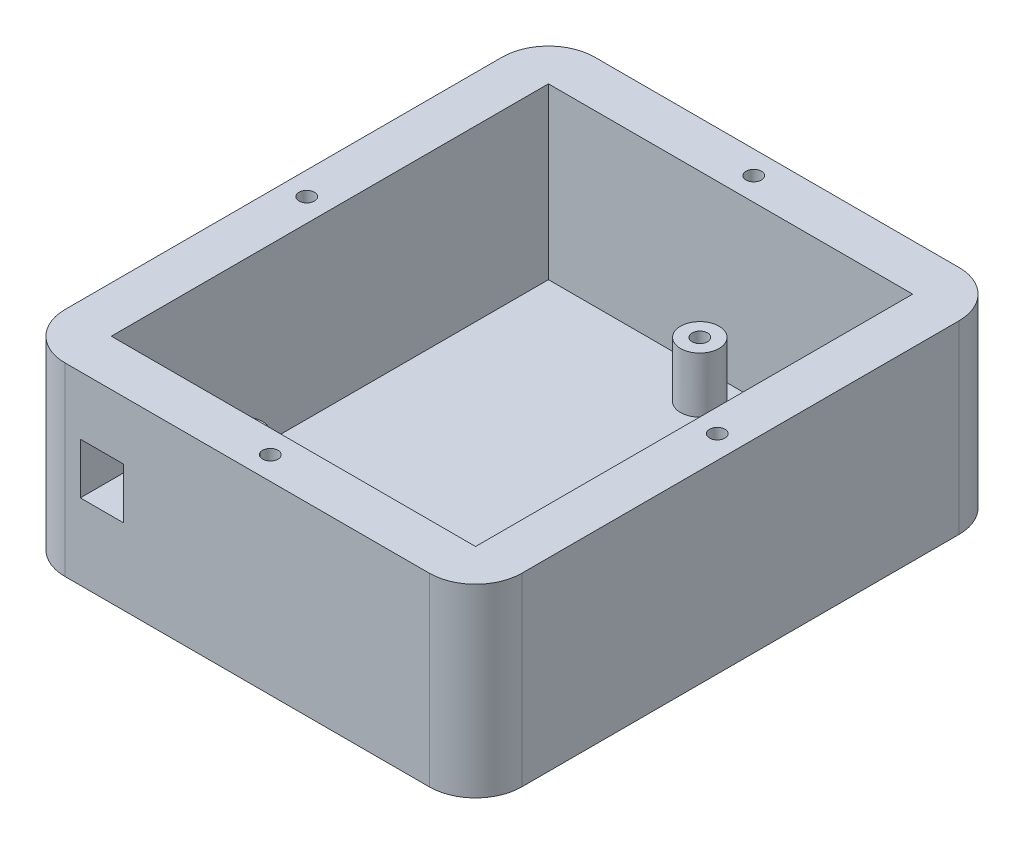
from build123d import *

# Parameters (mm, degrees)
BOSS_EXTRUDE1_DEPTH = 38.1
SKETCH2_W           = 75.000000114
SKETCH2_H           = 90.000000086
CUT_EXTRUDE1_DEPTH  = 34.925
SKETCH3_R           = 3.96875
SKETCH3_R_2         = 1.5875
BOSS_EXTRUDE2_DEPTH = 11.43
BOSS_EXTRUDE3_DEPTH = 38.1
SKETCH5_R           = 1.5875
CUT_EXTRUDE2_DEPTH  = 12.7
SKETCH9_W           = 8.89
SKETCH9_H           = 10.4775
CUT_EXTRUDE3_DEPTH  = 9.525


with BuildPart() as part:
    # Sketch1 → Boss-Extrude1 (new body)
    with BuildSketch(Plane(origin=(0, 0, 0), x_dir=(1, 0, 0), z_dir=(0, 1, 0))):
        with BuildLine():
            Line((3.175, 0), (78.175000114, 0))
            ThreePointArc((78.175000114, 0), (80.420064144, 0.92993597), (81.350000114, 3.175))
            Line((81.350000114, 3.175), (81.350000114, 93.175000086))
            ThreePointArc((81.350000114, 93.175000086), (80.420064144, 95.420064116), (78.175000114, 96.350000086))
            Line((78.175000114, 96.350000086), (3.175, 96.350000086))
            ThreePointArc((3.175, 96.350000086), (0.92993597, 95.420064116), (0, 93.175000086))
            Line((0, 93.175000086), (0, 3.175))
            ThreePointArc((0, 3.175), (0.92993597, 0.92993597), (3.175, 0))
        make_face()
    extrude(amount=BOSS_EXTRUDE1_DEPTH)

    # Sketch2 → Cut-Extrude1 (cut)
    with BuildSketch(Plane(origin=(0, 38.1, 0), x_dir=(1, 0, 0), z_dir=(0, 1, 0))):
        with Locations((40.675000057, 48.175000043)):
            Rectangle(SKETCH2_W, SKETCH2_H)
    extrude(amount=-CUT_EXTRUDE1_DEPTH, mode=Mode.SUBTRACT)

    # Sketch3 → Boss-Extrude2 (add)
    # profile 1 of 2: a face of its own
    with BuildSketch(Plane(origin=(0, 3.175, 0), x_dir=(1, 0, 0), z_dir=(0, 1, 0))):
        with Locations(Location((40.465000057, 87.050000043, 0), (0, 0, 90))):
            Circle(SKETCH3_R)
        with Locations(Location((40.465000057, 87.050000043, 0), (0, 0, 270))):
            Circle(SKETCH3_R_2, mode=Mode.SUBTRACT)
    # profile 2 of 2: a face of its own
    with BuildSketch(Plane(origin=(0, 3.175, 0), x_dir=(1, 0, 0), z_dir=(0, 1, 0))):
        with Locations(Location((10.465000057, 23.050000043, 0), (0, 0, 90))):
            Circle(SKETCH3_R)
        with Locations(Location((10.465000057, 23.050000043, 0), (0, 0, 270))):
            Circle(SKETCH3_R_2, mode=Mode.SUBTRACT)
    extrude(amount=BOSS_EXTRUDE2_DEPTH)

    # Sketch4 → Boss-Extrude3 (add)
    with BuildSketch(Plane.XZ):
        with BuildLine():
            Line((-6.35, -3.175), (-6.35, -93.175000086))
            ThreePointArc((-6.35, -93.175000086), (-3.560192091, -99.910192177), (3.175, -102.700000086))
            Line((3.175, -102.700000086), (78.175000114, -102.700000086))
            ThreePointArc((78.175000114, -102.700000086), (84.910192205, -99.910192177), (87.700000114, -93.175000086))
            Line((87.700000114, -93.175000086), (87.700000114, -3.175))
            ThreePointArc((87.700000114, -3.175), (84.910192205, 3.560192091), (78.175000114, 6.35))
            Line((78.175000114, 6.35), (3.175, 6.35))
            ThreePointArc((3.175, 6.35), (-3.560192091, 3.560192091), (-6.35, -3.175))
        make_face()
        with BuildLine():
            Line((0, -3.175), (0, -93.175000086))
            ThreePointArc((0, -93.175000086), (0.92993597, -95.420064116), (3.175, -96.350000086))
            Line((3.175, -96.350000086), (78.175000114, -96.350000086))
            ThreePointArc((78.175000114, -96.350000086), (80.420064144, -95.420064116), (81.350000114, -93.175000086))
            Line((81.350000114, -93.175000086), (81.350000114, -3.175))
            ThreePointArc((81.350000114, -3.175), (80.420064144, -0.92993597), (78.175000114, 0))
            Line((78.175000114, 0), (3.175, 0))
            ThreePointArc((3.175, 0), (0.92993597, -0.92993597), (0, -3.175))
        make_face(mode=Mode.SUBTRACT)
    extrude(amount=-BOSS_EXTRUDE3_DEPTH)

    # Sketch5 → Cut-Extrude2 (cut)
    with BuildSketch(Plane(origin=(0, 38.1, 0), x_dir=(1, 0, 0), z_dir=(0, 1, 0))):
        with Locations(Location((-1.5875, 48.175000043, 0), (0, 0, 270))):
            Circle(SKETCH5_R)
        with Locations(Location((40.675000057, 97.937500086, 0), (0, 0, 270))):
            Circle(SKETCH5_R)
        with Locations(Location((40.675000057, -1.5875, 0), (0, 0, 90))):
            Circle(SKETCH5_R)
        with Locations(Location((82.937500114, 48.175000043, 0), (0, 0, 90))):
            Circle(SKETCH5_R)
    extrude(amount=-CUT_EXTRUDE2_DEPTH, mode=Mode.SUBTRACT)

    # Sketch9 → Cut-Extrude3 (cut)
    with BuildSketch(Plane.XY.offset(6.35)):
        with Locations((10.765000057, 20.84375)):
            Rectangle(SKETCH9_W, SKETCH9_H)
    extrude(amount=-CUT_EXTRUDE3_DEPTH, mode=Mode.SUBTRACT)


solid = part.part
